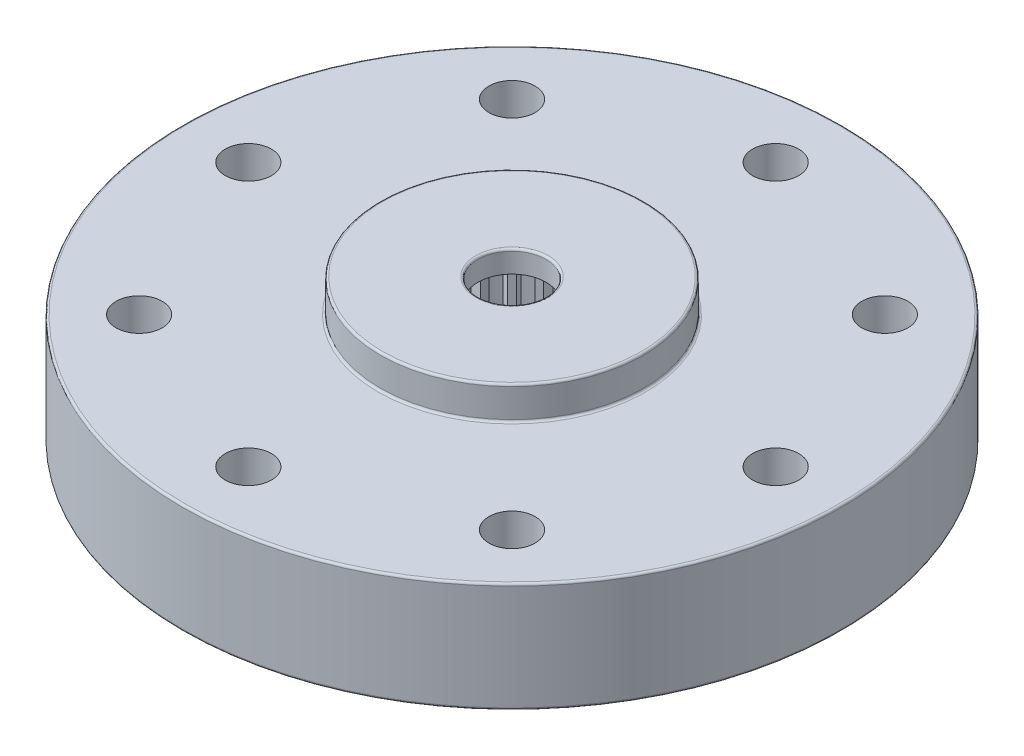
from build123d import *

# Parameters (mm, degrees)
ESQUISSE2_R                        = 15
ESQUISSE2_R_2                      = 1.55
BOSS_EXTRU_1_DEPTH                 = 6.5
ENL_V_START                        = -1.5
ESQUISSE3_R                        = 15
ESQUISSE3_R_2                      = 6
ENL_V_MAT_EXTRU_1_DEPTH            = 1.5
CONG_1_R                           = 0.1
ESQUISSE4_R                        = 1.05
ENL_V_MAT_EXTRU_2_DEPTH            = 5
R_P_TITION_CIRCULAIRE1_COUNT       = 8
ESQUISSE5_R                        = 4
ENL_V_MAT_EXTRU_3_DEPTH            = 5.5
ENL_V_MAT_EXTRU_4_DEPTH            = 2.5
CONG_2_R                           = 0.25
R_P_TITION_CIRCULAIRE2_COUNT       = 4
CONG_2_OF_R_P_TITION_CIRCULAIRE2_R = 0.25
BOSS_EXTRU_2_DEPTH                 = 5.5
R_P_TITION_CIRCULAIRE3_COUNT       = 24


with BuildPart() as part:
    # Esquisse2 → Boss.-Extru.1 (new body)
    with BuildSketch(Plane(origin=(0, 0, 0), x_dir=(1, 0, 0), z_dir=(0, 1, 0))):
        with Locations(Location((0, 0, 0), (0, 0, 90))):
            Circle(ESQUISSE2_R)
        with Locations(Location((0, 0, 0), (0, 0, 90))):
            Circle(ESQUISSE2_R_2, mode=Mode.SUBTRACT)
    extrude(amount=BOSS_EXTRU_1_DEPTH)

    # Esquisse3 → Enlèv. mat.-Extru.1 (cut)
    with BuildSketch(Plane(origin=(0, 6.5, 0), x_dir=(1, 0, 0), z_dir=(0, 1, 0)).offset(ENL_V_START)):
        with Locations(Location((0, 0, 0), (0, 0, 90))):
            Circle(ESQUISSE3_R)
        with Locations(Location((0, 0, 0), (0, 0, 270))):
            Circle(ESQUISSE3_R_2, mode=Mode.SUBTRACT)
    extrude(amount=ENL_V_MAT_EXTRU_1_DEPTH, mode=Mode.SUBTRACT)

    # Congé1
    cong_1_edges = [part.edges().sort_by_distance(p)[0] for p in [
        (0, 5, 15),
        (0, 5, -6),
        (0, 6.5, -6),
        (0, 0, 15),
        (0, 6.5, 1.55),
    ]]
    fillet(cong_1_edges, radius=CONG_1_R)

    # Esquisse4 → Enlèv. mat.-Extru.2 (cut)
    with BuildSketch(Plane.XZ):
        with Locations(Location((0, 12, 0), (0, 0, 270))):
            Circle(ESQUISSE4_R)
    enl_v_mat_extru_2 = extrude(amount=-ENL_V_MAT_EXTRU_2_DEPTH, mode=Mode.SUBTRACT)

    # Répétition circulaire1: Enlèv. mat.-Extru.2 ×8 about axis
    r_p_tition_circulaire1_axis = Axis((0, 0, 0), (0, 1, 0))
    for i in range(1, R_P_TITION_CIRCULAIRE1_COUNT):
        add(enl_v_mat_extru_2.rotate(r_p_tition_circulaire1_axis, i * 360 / R_P_TITION_CIRCULAIRE1_COUNT), mode=Mode.SUBTRACT)

    # Esquisse5 → Enlèv. mat.-Extru.3 (cut)
    with BuildSketch(Plane.XZ):
        with Locations(Location((0, 0, 0), (0, 0, 270))):
            Circle(ESQUISSE5_R)
    extrude(amount=-ENL_V_MAT_EXTRU_3_DEPTH, mode=Mode.SUBTRACT)

    # Esquisse6 → Enlèv. mat.-Extru.4 (cut)
    with BuildSketch(Plane.XZ):
        with BuildLine():
            Line((1.1, 8.706246951), (1.1, 6.406246951))
            ThreePointArc((1.1, 6.406246951), (4.596194078, 4.596194078), (6.406246951, 1.1))
            Line((6.406246951, 1.1), (8.706246951, 1.1))
            ThreePointArc((8.706246951, 1.1), (6.205188796, 6.205188796), (1.1, 8.706246951))
        make_face()
    enl_v_mat_extru_4 = extrude(amount=-ENL_V_MAT_EXTRU_4_DEPTH, mode=Mode.SUBTRACT)

    # Congé2
    cong_2_edges = [part.edges().sort_by_distance(p)[0] for p in [
        (6.406246951, 1.25, 1.1),
        (1.1, 1.25, 6.406246951),
        (1.1, 1.25, 8.706246951),
        (8.706246951, 1.25, 1.1),
    ]]
    fillet(cong_2_edges, radius=CONG_2_R)

    # Répétition circulaire2: Enlèv. mat.-Extru.4 ×4 about axis
    r_p_tition_circulaire2_axis = Axis((0, 0, 0), (0, 1, 0))
    for i in range(1, R_P_TITION_CIRCULAIRE2_COUNT):
        add(enl_v_mat_extru_4.rotate(r_p_tition_circulaire2_axis, i * 360 / R_P_TITION_CIRCULAIRE2_COUNT), mode=Mode.SUBTRACT)

    # Congé2 of Répétition circulaire2
    cong_2_of_r_p_tition_circulaire2_edges = [part.edges().sort_by_distance(p)[0] for p in [
        (1.1, 1.25, -6.406246951),
        (6.406246951, 1.25, -1.1),
        (8.706246951, 1.25, -1.1),
        (1.1, 1.25, -8.706246951),
        (-6.406246951, 1.25, -1.1),
        (-1.1, 1.25, -6.406246951),
        (-1.1, 1.25, -8.706246951),
        (-8.706246951, 1.25, -1.1),
        (-1.1, 1.25, 6.406246951),
        (-6.406246951, 1.25, 1.1),
        (-8.706246951, 1.25, 1.1),
        (-1.1, 1.25, 8.706246951),
    ]]
    fillet(cong_2_of_r_p_tition_circulaire2_edges, radius=CONG_2_OF_R_P_TITION_CIRCULAIRE2_R)

    # Esquisse7 → Boss.-Extru.2 (add)
    with BuildSketch(Plane.XZ):
        Polygon((0.3, 4), (-0.3, 4), (-0.139230485, 3.4), (0.139230485, 3.4), align=None)
    boss_extru_2 = extrude(amount=-BOSS_EXTRU_2_DEPTH)

    # Répétition circulaire3: Boss.-Extru.2 ×24 about axis
    r_p_tition_circulaire3_axis = Axis((0, 0, 0), (0, 1, 0))
    for i in range(1, R_P_TITION_CIRCULAIRE3_COUNT):
        add(boss_extru_2.rotate(r_p_tition_circulaire3_axis, i * 360 / R_P_TITION_CIRCULAIRE3_COUNT))


solid = part.part
